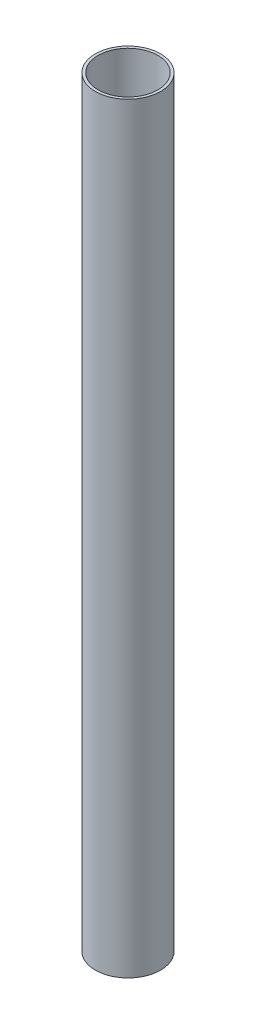
from build123d import *

# Parameters (mm, degrees)
SKETCH1_R           = 6
SKETCH1_R_2         = 5.5
BOSS_EXTRUDE1_DEPTH = 140


with BuildPart() as part:
    # Sketch1 → Boss-Extrude1 (new body)
    with BuildSketch(Plane(origin=(0, 0, 0), x_dir=(1, 0, 0), z_dir=(0, 1, 0))):
        with Locations(Location((0, 0, 0), (0, 0, 270))):
            Circle(SKETCH1_R)
        with Locations(Location((0, 0, 0), (0, 0, 270))):
            Circle(SKETCH1_R_2, mode=Mode.SUBTRACT)
    extrude(amount=BOSS_EXTRUDE1_DEPTH)


solid = part.part
